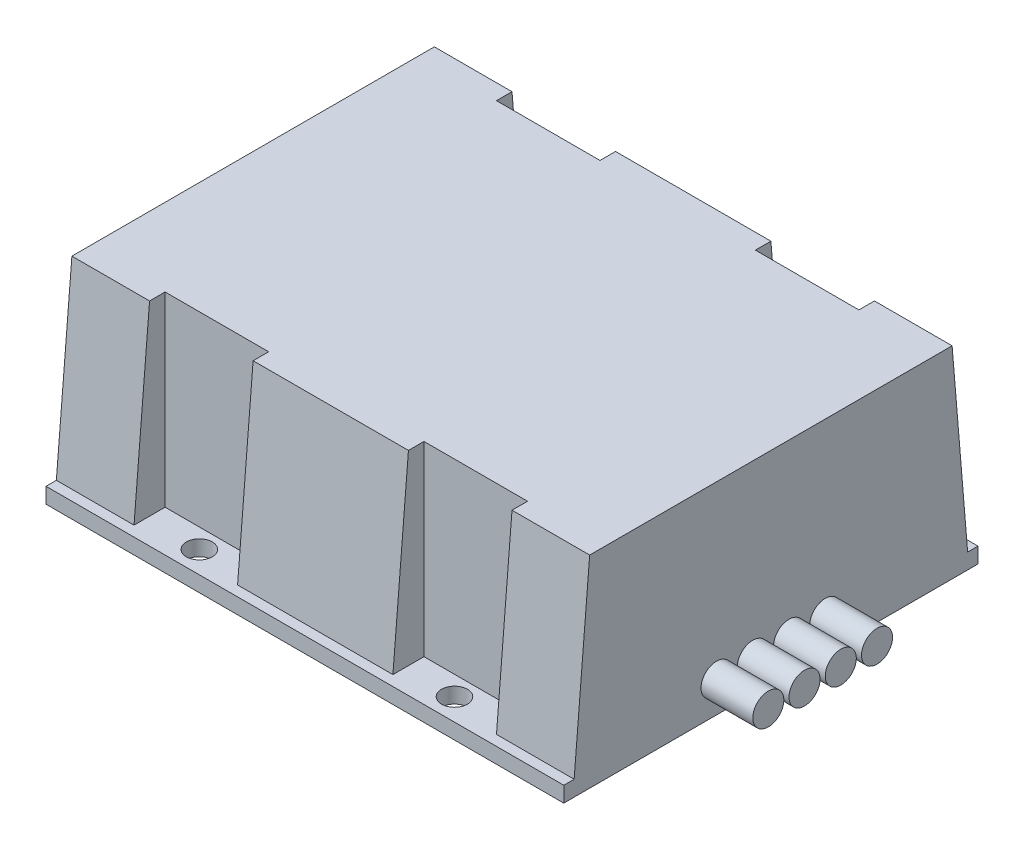
from build123d import *

# Parameters (mm, degrees)
SKETCH_1_W          = 100
SKETCH_1_H          = 80
EXTRUDE_1_DEPTH     = 39
SKETCH_5_R          = 3
EXTRUDE_3_DEPTH     = 10
CUT_EXTRUDE_1_DEPTH = 1000
SKETCH_9_W          = 20
SKETCH_9_H          = 6.479518585
SKETCH_9_H_2        = 3
SKETCH_9_H_3        = 8.519653391
SKETCH_9_H_4        = 11.10220699
SKETCH_9_H_5        = 8.801039891
CUT_EXTRUDE_3_DEPTH = 36
SKETCH_10_R         = 2.5
CUT_EXTRUDE_4_DEPTH = 36


with BuildPart() as part:
    # 草图1 → 凸台-拉伸1 (new body)
    with BuildSketch(Plane(origin=(0, 0, 0), x_dir=(1, 0, 0), z_dir=(0, 1, 0))):
        with Locations((50, -40)):
            Rectangle(SKETCH_1_W, SKETCH_1_H)
    extrude(amount=EXTRUDE_1_DEPTH)

    # 草图5 → 凸台-拉伸3 (add)
    with BuildSketch(Plane(origin=(100, 0, 0), x_dir=(0, 0, -1), z_dir=(1, 0, 0))):
        with Locations(Location((-50.5, 6, 0), (0, 0, 180))):
            Circle(SKETCH_5_R)
        with Locations(Location((-43.5, 6, 0), (0, 0, 180))):
            Circle(SKETCH_5_R)
        with Locations(Location((-36.5, 6, 0), (0, 0, 180))):
            Circle(SKETCH_5_R)
        with Locations(Location((-29.5, 6, 0), (0, 0, 180))):
            Circle(SKETCH_5_R)
    extrude(amount=EXTRUDE_3_DEPTH)

    # 草图8 → 切除-拉伸1 (cut)
    with BuildSketch(Plane(origin=(100, 0, 0), x_dir=(0, 0, -1), z_dir=(1, 0, 0))):
        Polygon((-78, 3), (-75, 39), (-80, 39), (-80, 3), align=None)
        Polygon((0, 3), (0, 39), (-5, 39), (-2, 3), align=None)
    extrude(amount=-CUT_EXTRUDE_1_DEPTH, mode=Mode.SUBTRACT)

    # 草图9 → 切除-拉伸3 (cut)
    with BuildSketch(Plane(origin=(0, 39, 0), x_dir=(1, 0, 0), z_dir=(0, 1, 0))):
        with Locations((25, -1.760240707)):
            Rectangle(SKETCH_9_W, SKETCH_9_H)
        with Locations((25, -6.5)):
            Rectangle(SKETCH_9_W, SKETCH_9_H_2)
        with Locations((75, -0.740173304)):
            Rectangle(SKETCH_9_W, SKETCH_9_H_3)
        with Locations((75, -6.5)):
            Rectangle(SKETCH_9_W, SKETCH_9_H_2)
        with Locations((75, -80.551103495)):
            Rectangle(SKETCH_9_W, SKETCH_9_H_4)
        with Locations((75, -73.5)):
            Rectangle(SKETCH_9_W, SKETCH_9_H_2)
        with Locations((25, -79.400519946)):
            Rectangle(SKETCH_9_W, SKETCH_9_H_5)
        with Locations((25, -73.5)):
            Rectangle(SKETCH_9_W, SKETCH_9_H_2)
    extrude(amount=-CUT_EXTRUDE_3_DEPTH, mode=Mode.SUBTRACT)

    # 草图10 → 切除-拉伸4 (cut)
    with BuildSketch(Plane(origin=(0, 3, 0), x_dir=(1, 0, 0), z_dir=(0, 1, 0))):
        with Locations(Location((25, -4, 0), (0, 0, 270))):
            Circle(SKETCH_10_R)
        with Locations(Location((25.358741031, -75.748206295, 0), (0, 0, 270))):
            Circle(SKETCH_10_R)
        with Locations(Location((75, -4, 0), (0, 0, 270))):
            Circle(SKETCH_10_R)
        with Locations(Location((74.641258969, -75.748206295, 0), (0, 0, 270))):
            Circle(SKETCH_10_R)
    extrude(amount=-CUT_EXTRUDE_4_DEPTH, mode=Mode.SUBTRACT)


solid = part.part
